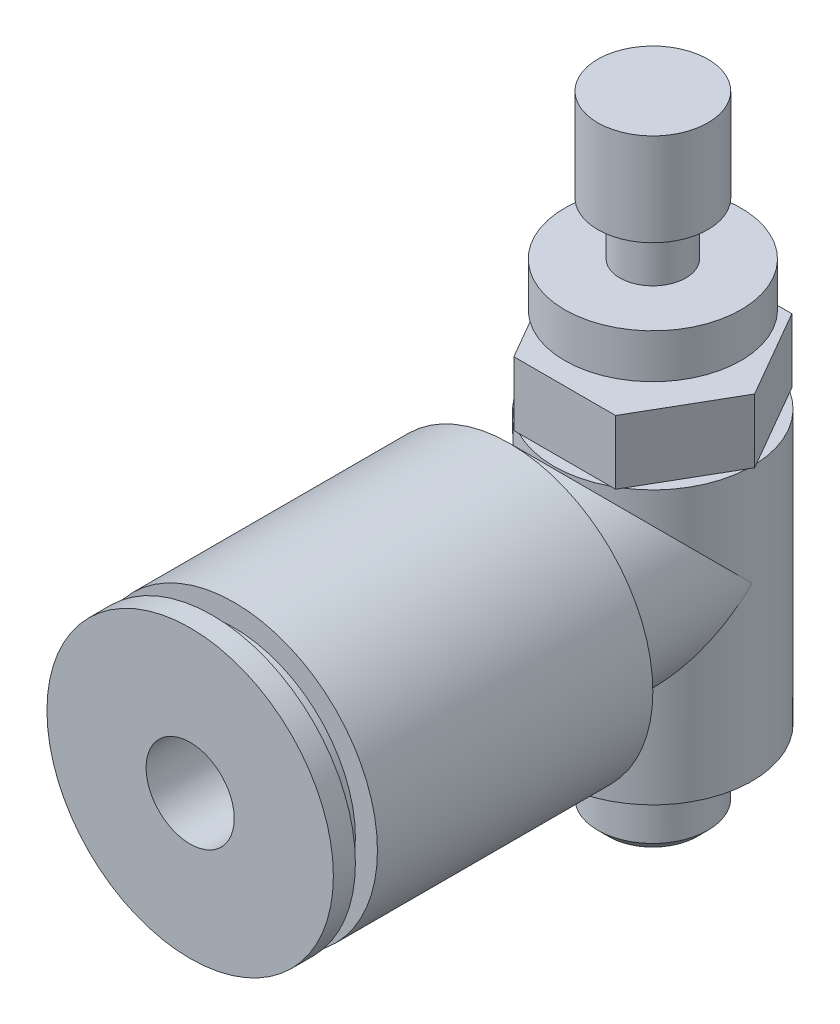
from build123d import *

# Parameters (mm, degrees)
EXTRUDE_1_DEPTH     = 2.9
HOLE_WIZARD_1_D     = 4
HOLE_WIZARD_1_DEPTH = 16
CHAMFER_1_SIZE      = 0.49


with BuildPart() as part:
    # 草图1 → 凸台-拉伸1 (new body)
    with BuildSketch(Plane(origin=(0, 7.5, 0), x_dir=(-1, 0, 0), z_dir=(0, 1, 0))):
        Polygon((2.309401077, 4), (-2.309401077, 4), (-4.618802154, 0), (-2.309401077, -4), (2.309401077, -4), (4.618802154, 0), align=None)
    extrude(amount=-EXTRUDE_1_DEPTH)

    # 草图2 → 旋转1 (revolve)
    with BuildSketch(Plane(origin=(0, 0, 0), x_dir=(-1, 0, 0), z_dir=(0, 0, -1)), mode=Mode.PRIVATE) as revolve_1_sk:
        Polygon((-2.5, -11.2), (0, -11.2), (0, 4.6), (-4.5, 4.6), (-4.5, -7.78), (-2.5, -7.78), align=None)
    revolve(revolve_1_sk.sketch.rotate(Axis((0, -11.2, 0), (0, 1, 0)), 270), axis=Axis((0, -11.2, 0), (0, 1, 0)))

    # 草图3 → 旋转2 (revolve)
    with BuildSketch(Plane(origin=(0, 0, 0), x_dir=(1, 0, 0), z_dir=(0, 1, 0))):
        Polygon((0, -21), (6.5, -21), (6.5, -20), (5.5, -20), (5.5, -19), (6.5, -19), (6.5, -6.5), (4.5, -6.5), (4.5, 0), (0, 0), align=None)
    revolve(axis=Axis((0, 0, 0), (0, 0, 1)))

    # 草图4 → 旋转3 (revolve)
    with BuildSketch(Plane(origin=(0, 0, 0), x_dir=(-1, 0, 0), z_dir=(0, 0, -1)), mode=Mode.PRIVATE) as revolve_3_sk:
        Polygon((-2.5, 7.5), (0, 7.5), (0, 17.1), (-2.5, 17.1), (-2.5, 12.9), (-1.5, 12.9), (-1.5, 10.5), (-4, 10.5), (-4, 8.5), (-2.5, 8.5), align=None)
    revolve(revolve_3_sk.sketch.rotate(Axis((0, 7.5, 0), (0, 1, 0)), 270), axis=Axis((0, 7.5, 0), (0, 1, 0)))

    # 孔1
    with Locations(Plane.XY.offset(21)):
        with Locations((0, 0)):
            Hole(HOLE_WIZARD_1_D / 2, depth=HOLE_WIZARD_1_DEPTH)

    # 倒角1
    chamfer_1_edges = [part.edges().sort_by_distance(p)[0] for p in [
        (0, -11.2, -2.5),
    ]]
    chamfer(chamfer_1_edges, length=CHAMFER_1_SIZE)


solid = part.part
